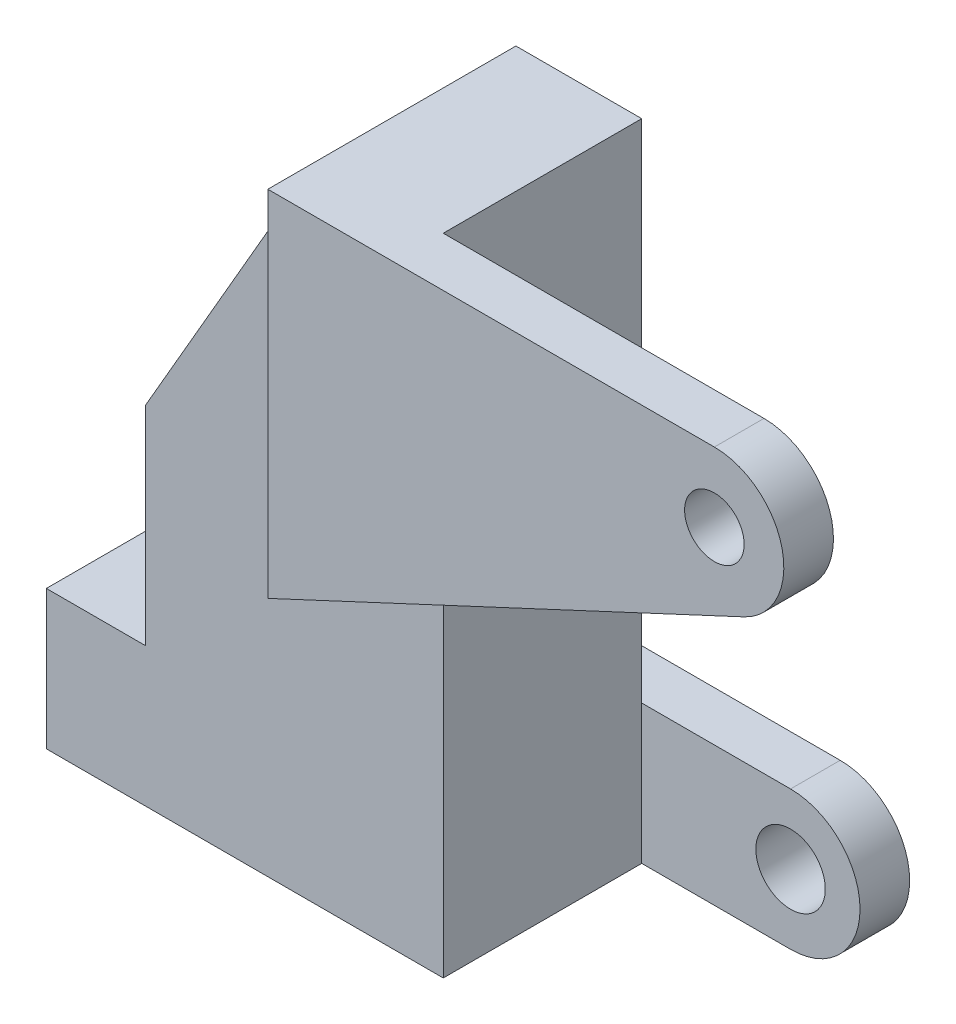
from build123d import *

# Parameters (mm, degrees)
BOSS_EXTRUDE1_DEPTH = 20
SKETCH2_R           = 3
BOSS_EXTRUDE2_DEPTH = 5
SKETCH3_R           = 3.5
BOSS_EXTRUDE3_DEPTH = 5


with BuildPart() as part:
    # Sketch1 → Boss-Extrude1 (new body)
    with BuildSketch(Plane.XY):
        Polygon((0, 0), (40, 0), (40, 65), (27.320508076, 65), (10, 35), (10, 14), (0, 14), align=None)
    extrude(amount=BOSS_EXTRUDE1_DEPTH)

    # Sketch2 → Boss-Extrude2 (add)
    with BuildSketch(Plane.XY.offset(20)):
        with BuildLine():
            Line((27.320508076, 65), (27.320508076, 29.29250995))
            Line((27.320508076, 29.29250995), (75.278835908, 51.655845491))
            ThreePointArc((75.278835908, 51.655845491), (79.154580126, 59.515077298), (72.320508076, 65))
            Line((72.320508076, 65), (27.320508076, 65))
        make_face()
        with Locations((72.320508076, 58)):
            Circle(SKETCH2_R, mode=Mode.SUBTRACT)
    extrude(amount=BOSS_EXTRUDE2_DEPTH)

    # Sketch3 → Boss-Extrude3 (add)
    with BuildSketch(Plane(origin=(0, 0, 0), x_dir=(-1, 0, 0), z_dir=(0, 0, -1))):
        with BuildLine():
            Line((-10, 14), (-55, 14))
            ThreePointArc((-55, 14), (-62, 7), (-55, 0))
            Line((-55, 0), (-10, 0))
            Line((-10, 0), (-10, 14))
        make_face()
        with Locations((-55, 7)):
            Circle(SKETCH3_R, mode=Mode.SUBTRACT)
    extrude(amount=BOSS_EXTRUDE3_DEPTH)


solid = part.part
